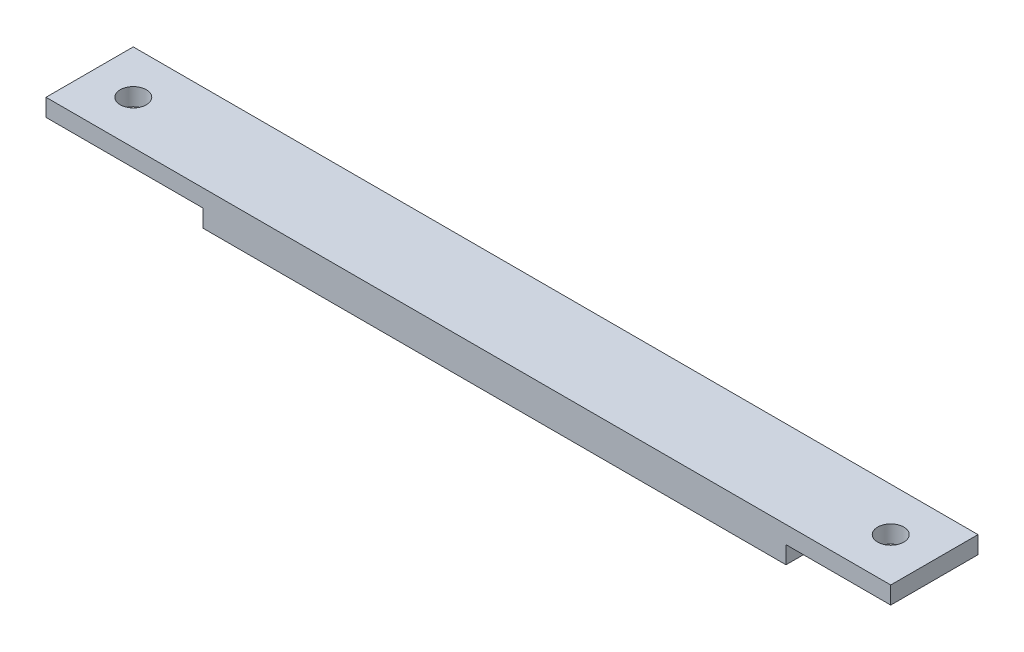
from build123d import *

# Parameters (mm, degrees)
CROQUIS2_W              = 96.8
CROQUIS2_H              = 2
SALIENTE_EXTRUIR2_DEPTH = 10
CROQUIS3_W              = 66.8
CROQUIS3_H              = 10
SALIENTE_EXTRUIR3_DEPTH = 2
CROQUIS5_R              = 1.5
CORTAR_EXTRUIR1_DEPTH   = 2


with BuildPart() as part:
    # Croquis2 → Saliente-Extruir2 (new body)
    with BuildSketch(Plane.XY):
        Rectangle(CROQUIS2_W, CROQUIS2_H)
    extrude(amount=SALIENTE_EXTRUIR2_DEPTH)

    # Croquis3 → Saliente-Extruir3 (add)
    with BuildSketch(Plane.XZ.offset(1)):
        with Locations((3, 5)):
            Rectangle(CROQUIS3_W, CROQUIS3_H)
    extrude(amount=SALIENTE_EXTRUIR3_DEPTH)

    # Croquis5 → Cortar-Extruir1 (cut)
    with BuildSketch(Plane.XZ.offset(1)):
        with Locations(Location((43.4, 5, 0), (0, 0, 270))):
            Circle(CROQUIS5_R)
        with Locations(Location((-43.4, 5, 0), (0, 0, 90))):
            Circle(CROQUIS5_R)
    extrude(amount=-CORTAR_EXTRUIR1_DEPTH, mode=Mode.SUBTRACT)


solid = part.part
